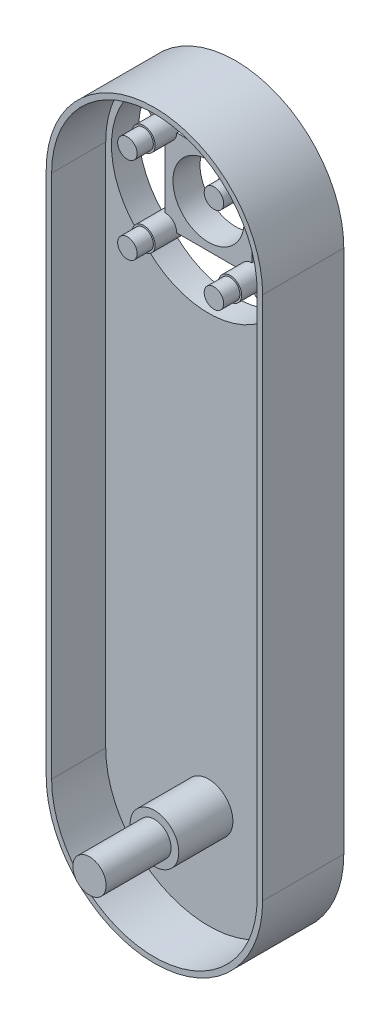
from build123d import *
from build123d.topology import SkipClean

# Parameters (mm, degrees)
SKETCH2_R           = 6.575
BOSS_EXTRUDE1_DEPTH = 5
SKETCH3_R           = 4.5
BOSS_EXTRUDE2_DEPTH = 10
SKETCH4_R           = 2.125
BOSS_EXTRUDE3_DEPTH = 4
SKETCH5_R           = 1.8
BOSS_EXTRUDE4_DEPTH = 3
BOSS_EXTRUDE5_DEPTH = 10
CUT_EXTRUDE1_START  = -10
CUT_EXTRUDE1_DEPTH  = 10
SKETCH8_R           = 3.075
BOSS_EXTRUDE6_DEPTH = 12
CUT_EXTRUDE2_DEPTH  = 10


with BuildPart() as part:
    # Sketch2 → Boss-Extrude1 (new body)
    with BuildSketch(Plane.XY):
        with BuildLine():
            Line((-20, 0), (-20, -97))
            ThreePointArc((-20, -97), (0, -117), (20, -97))
            Line((20, -97), (20, 0))
            ThreePointArc((20, 0), (0, 20), (-20, 0))
        make_face()
        Circle(SKETCH2_R, mode=Mode.SUBTRACT)
    extrude(amount=BOSS_EXTRUDE1_DEPTH)

    # Sketch3 → Boss-Extrude2 (add)
    with BuildSketch(Plane.XY.offset(5)):
        with Locations((0, -97)):
            Circle(SKETCH3_R)
    extrude(amount=BOSS_EXTRUDE2_DEPTH)

    # Sketch4 → Boss-Extrude3 (add)
    with BuildSketch(Plane.XY.offset(5)):
        with Locations((-8, 8)):
            Circle(SKETCH4_R)
        with Locations((8, 8)):
            Circle(SKETCH4_R)
        with Locations((8, -8)):
            Circle(SKETCH4_R)
        with Locations((-8, -8)):
            Circle(SKETCH4_R)
    extrude(amount=BOSS_EXTRUDE3_DEPTH)

    # Sketch5 → Boss-Extrude4 (add)
    with BuildSketch(Plane.XY.offset(9)):
        with Locations((-8, 8)):
            Circle(SKETCH5_R)
        with Locations((8, 8)):
            Circle(SKETCH5_R)
        with Locations((8, -8)):
            Circle(SKETCH5_R)
        with Locations((-8, -8)):
            Circle(SKETCH5_R)
    extrude(amount=BOSS_EXTRUDE4_DEPTH)

    # Sketch6 → Boss-Extrude5 (add)
    with BuildSketch(Plane.XY.offset(5)):
        with BuildLine():
            Line((20, -97), (20, 0))
            ThreePointArc((20, 0), (0, 20), (-20, 0))
            Line((-20, 0), (-20, -97))
            ThreePointArc((-20, -97), (0, -117), (20, -97))
        make_face()
        with BuildLine():
            Line((-19, 0), (-19, -97))
            ThreePointArc((-19, -97), (0, -116), (19, -97))
            Line((19, -97), (19, 0))
            ThreePointArc((19, 0), (0, 19), (-19, 0))
        make_face(mode=Mode.SUBTRACT)
    extrude(amount=BOSS_EXTRUDE5_DEPTH)

    # Sketch7 → Cut-Extrude1 (cut)
    with BuildSketch(Plane.XY.offset(5).offset(CUT_EXTRUDE1_START)):
        with BuildLine():
            Line((-10.125, 8), (-10.125, -8))
            ThreePointArc((-10.125, -8), (-9.50260191, -6.49739809), (-8, -5.875))
            Line((-8, -5.875), (-8, 5.875))
            ThreePointArc((-8, 5.875), (-9.50260191, 6.49739809), (-10.125, 8))
        make_face()
        with BuildLine():
            Line((-8, -10.125), (8, -10.125))
            ThreePointArc((8, -10.125), (6.49739809, -9.50260191), (5.875, -8))
            Line((5.875, -8), (-5.875, -8))
            ThreePointArc((-5.875, -8), (-6.49739809, -9.50260191), (-8, -10.125))
        make_face()
        with BuildLine():
            Line((10.125, -8), (10.125, 8))
            ThreePointArc((10.125, 8), (9.50260191, 6.49739809), (8, 5.875))
            Line((8, 5.875), (8, -5.875))
            ThreePointArc((8, -5.875), (9.50260191, -6.49739809), (10.125, -8))
        make_face()
        with BuildLine():
            Line((8, 10.125), (-8, 10.125))
            ThreePointArc((-8, 10.125), (-6.49739809, 9.50260191), (-5.875, 8))
            Line((-5.875, 8), (5.875, 8))
            ThreePointArc((5.875, 8), (6.49739809, 9.50260191), (8, 10.125))
        make_face()
    extrude(amount=CUT_EXTRUDE1_DEPTH, mode=Mode.SUBTRACT)

    # Sketch8 → Boss-Extrude6 (add)
    with BuildSketch(Plane.XY.offset(15)):
        with Locations((0, -97)):
            Circle(SKETCH8_R)
    extrude(amount=BOSS_EXTRUDE6_DEPTH)

    # Sketch10 → Cut-Extrude2 (cut)
    with SkipClean():  # the faces are left unmerged after this step: merging them gives an invalid solid
        with BuildSketch(Plane(origin=(0, 0, 0), x_dir=(-1, 0, 0), z_dir=(0, 0, -1))):
            with BuildLine():
                Line((-8, 10.125), (-11.181980515, 13.306980515))
                ThreePointArc((-11.181980515, 13.306980515), (0, 17.938708499), (11.181980515, 13.306980515))
                Line((11.181980515, 13.306980515), (8, 10.125))
                Line((8, 10.125), (-8, 10.125))
            make_face()
            with BuildLine():
                Line((-10.125, 8), (-13.306980515, 11.181980515))
                ThreePointArc((-13.306980515, 11.181980515), (-17.938708499, 0), (-13.306980515, -11.181980515))
                Line((-13.306980515, -11.181980515), (-10.125, -8))
                Line((-10.125, -8), (-10.125, 8))
            make_face()
            with BuildLine():
                Line((10.125, 8), (13.306980515, 11.181980515))
                ThreePointArc((13.306980515, 11.181980515), (17.938708499, 0), (13.306980515, -11.181980515))
                Line((13.306980515, -11.181980515), (10.125, -8))
                Line((10.125, -8), (10.125, 8))
            make_face()
            with BuildLine():
                Line((8, -10.125), (11.181980515, -13.306980515))
                ThreePointArc((11.181980515, -13.306980515), (0, -17.938708499), (-11.181980515, -13.306980515))
                Line((-11.181980515, -13.306980515), (-8, -10.125))
                Line((-8, -10.125), (8, -10.125))
            make_face()
        extrude(amount=-CUT_EXTRUDE2_DEPTH, mode=Mode.SUBTRACT)


solid = part.part
